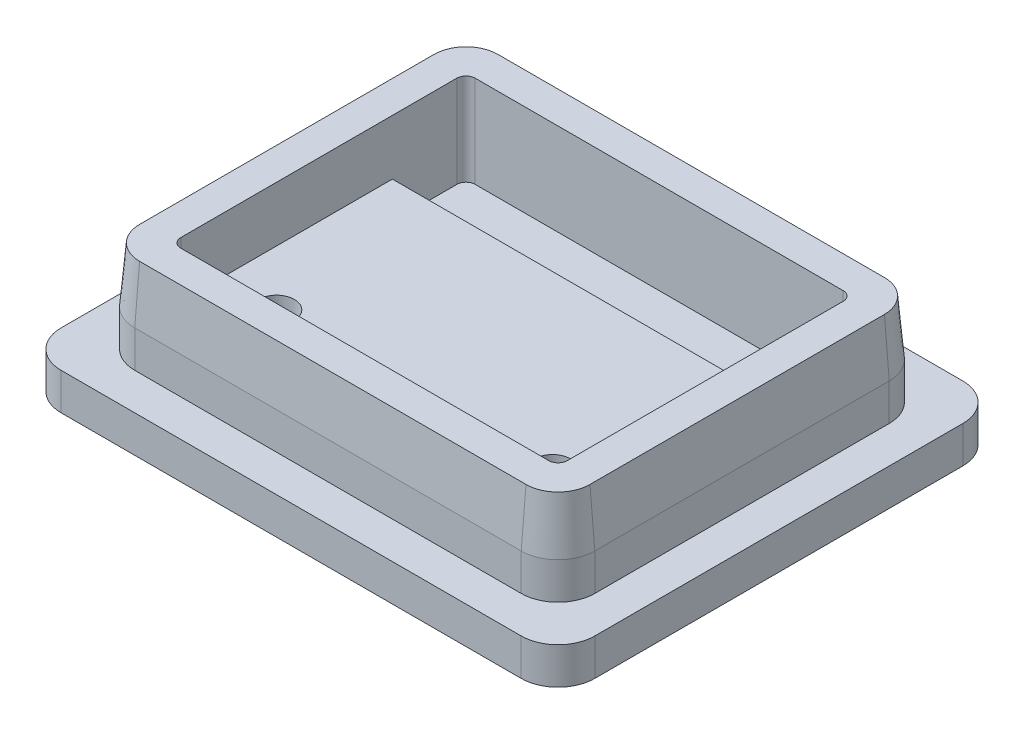
from build123d import *
from OCP.BRepFilletAPI import BRepFilletAPI_MakeChamfer

# Parameters (mm, degrees)
SKETCH1_W           = 29
SKETCH1_H           = 24
BOSS_EXTRUDE1_DEPTH = 2
SKETCH2_W           = 25
SKETCH2_H           = 20
SKETCH2_W_2         = 21
SKETCH2_H_2         = 16
BOSS_EXTRUDE2_DEPTH = 5
SKETCH3_W           = 21
SKETCH3_H           = 12
SKETCH3_R           = 0.975
BOSS_EXTRUDE3_DEPTH = 2
FILLET1_R           = 2
FILLET5_R           = 0.5
CHAMFER1_SIZE       = 3
CHAMFER1_SIZE2      = 0.262465991


with BuildPart() as part:
    # Sketch1 → Boss-Extrude1 (new body)
    with BuildSketch(Plane(origin=(0, 0, 0), x_dir=(1, 0, 0), z_dir=(0, 1, 0))):
        Rectangle(SKETCH1_W, SKETCH1_H)
    extrude(amount=BOSS_EXTRUDE1_DEPTH)

    # Sketch2 → Boss-Extrude2 (add)
    with BuildSketch(Plane(origin=(0, 2, 0), x_dir=(1, 0, 0), z_dir=(0, 1, 0))):
        Rectangle(SKETCH2_W, SKETCH2_H)
        Rectangle(SKETCH2_W_2, SKETCH2_H_2, mode=Mode.SUBTRACT)
    extrude(amount=BOSS_EXTRUDE2_DEPTH)

    # Sketch3 → Boss-Extrude3 (add)
    with BuildSketch(Plane(origin=(0, 2, 0), x_dir=(1, 0, 0), z_dir=(0, 1, 0))):
        with Locations((0, -2)):
            Rectangle(SKETCH3_W, SKETCH3_H)
        with Locations(Location((-7.5, -5.3, 0), (0, 0, 270))):
            Circle(SKETCH3_R, mode=Mode.SUBTRACT)
        with Locations(Location((7.5, -5.3, 0), (0, 0, 90))):
            Circle(SKETCH3_R, mode=Mode.SUBTRACT)
    extrude(amount=BOSS_EXTRUDE3_DEPTH)

    # Fillet1
    fillet1_edges = [part.edges().sort_by_distance(p)[0] for p in [
        (-12.5, 4.5, -10),
        (-12.5, 4.5, 10),
        (12.5, 4.5, 10),
        (12.5, 4.5, -10),
        (14.5, 1, 12),
        (-14.5, 1, 12),
        (-14.5, 1, -12),
        (14.5, 1, -12),
    ]]
    fillet(fillet1_edges, radius=FILLET1_R)

    # Fillet5
    fillet5_edges = [part.edges().sort_by_distance(p)[0] for p in [
        (10.5, 4.5, -8),
        (-10.5, 4.5, -8),
        (-10.5, 5.5, 8),
        (10.5, 5.5, 8),
    ]]
    fillet(fillet5_edges, radius=FILLET5_R)

    # Chamfer1: one chamfer whose edges measure the first distance from different faces: ONE call of the kernel's chamfer builder (chamfer() names one face for all edges)
    chamfer1_edges_1 = [part.edges().sort_by_distance(p)[0] for p in [
        (0, 7, -10),
    ]]
    chamfer1_side_1 = [part.faces().sort_by_distance(p)[0] for p in [
        (0, 4.5, -10),
    ]]
    chamfer1_edges_2 = [part.edges().sort_by_distance(p)[0] for p in [
        (12.5, 7, 0),
    ]]
    chamfer1_side_2 = [part.faces().sort_by_distance(p)[0] for p in [
        (12.5, 4.5, 0),
    ]]
    chamfer1_edges_3 = [part.edges().sort_by_distance(p)[0] for p in [
        (-12.5, 7, 0),
    ]]
    chamfer1_side_3 = [part.faces().sort_by_distance(p)[0] for p in [
        (-12.5, 4.5, 0),
    ]]
    chamfer1_edges_4 = [part.edges().sort_by_distance(p)[0] for p in [
        (0, 7, 10),
    ]]
    chamfer1_side_4 = [part.faces().sort_by_distance(p)[0] for p in [
        (0, 4.5, 10),
    ]]
    chamfer1_edges_5 = [part.edges().sort_by_distance(p)[0] for p in [
        (-11.914213562, 7, -9.414213562),
    ]]
    chamfer1_side_5 = [part.faces().sort_by_distance(p)[0] for p in [
        (-11.914213562, 4.5, -9.414213562),
    ]]
    chamfer1_edges_6 = [part.edges().sort_by_distance(p)[0] for p in [
        (-11.914213562, 7, 9.414213562),
    ]]
    chamfer1_side_6 = [part.faces().sort_by_distance(p)[0] for p in [
        (-11.914213562, 4.5, 9.414213562),
    ]]
    chamfer1_edges_7 = [part.edges().sort_by_distance(p)[0] for p in [
        (11.914213562, 7, 9.414213562),
    ]]
    chamfer1_side_7 = [part.faces().sort_by_distance(p)[0] for p in [
        (11.914213562, 4.5, 9.414213562),
    ]]
    chamfer1_edges_8 = [part.edges().sort_by_distance(p)[0] for p in [
        (11.914213562, 7, -9.414213562),
    ]]
    chamfer1_side_8 = [part.faces().sort_by_distance(p)[0] for p in [
        (11.914213562, 4.5, -9.414213562),
    ]]
    chamfer1 = BRepFilletAPI_MakeChamfer(part.part.solid().wrapped)
    for e in chamfer1_edges_1:
        chamfer1.Add(CHAMFER1_SIZE, CHAMFER1_SIZE2, e.wrapped, chamfer1_side_1[0].wrapped)  # the first distance lies on this face
    for e in chamfer1_edges_2:
        chamfer1.Add(CHAMFER1_SIZE, CHAMFER1_SIZE2, e.wrapped, chamfer1_side_2[0].wrapped)  # the first distance lies on this face
    for e in chamfer1_edges_3:
        chamfer1.Add(CHAMFER1_SIZE, CHAMFER1_SIZE2, e.wrapped, chamfer1_side_3[0].wrapped)  # the first distance lies on this face
    for e in chamfer1_edges_4:
        chamfer1.Add(CHAMFER1_SIZE, CHAMFER1_SIZE2, e.wrapped, chamfer1_side_4[0].wrapped)  # the first distance lies on this face
    for e in chamfer1_edges_5:
        chamfer1.Add(CHAMFER1_SIZE, CHAMFER1_SIZE2, e.wrapped, chamfer1_side_5[0].wrapped)  # the first distance lies on this face
    for e in chamfer1_edges_6:
        chamfer1.Add(CHAMFER1_SIZE, CHAMFER1_SIZE2, e.wrapped, chamfer1_side_6[0].wrapped)  # the first distance lies on this face
    for e in chamfer1_edges_7:
        chamfer1.Add(CHAMFER1_SIZE, CHAMFER1_SIZE2, e.wrapped, chamfer1_side_7[0].wrapped)  # the first distance lies on this face
    for e in chamfer1_edges_8:
        chamfer1.Add(CHAMFER1_SIZE, CHAMFER1_SIZE2, e.wrapped, chamfer1_side_8[0].wrapped)  # the first distance lies on this face
    add(Compound.cast(chamfer1.Shape()), mode=Mode.REPLACE)


solid = part.part
